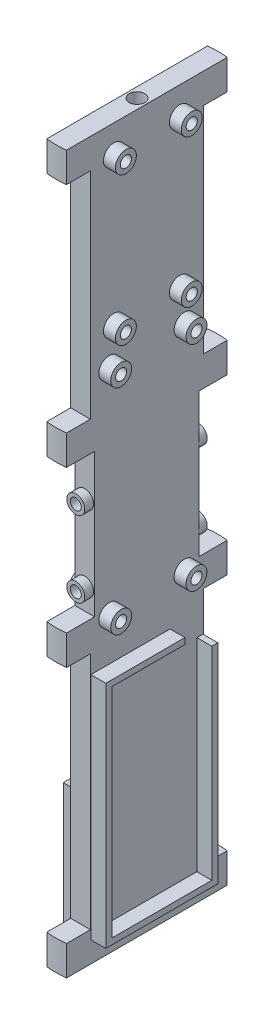
from build123d import *

# Parameters (mm, degrees)
SKETCH1_R                            = 1.651
BOSS_EXTRUDE1_DEPTH                  = 152.4
SKETCH2_W                            = 4.191
SKETCH2_H                            = 30.48
CUT_EXTRUDE1_DEPTH                   = 6.096
SKETCH3_R                            = 1.905
BOSS_EXTRUDE2_DEPTH                  = 1.905
SKETCH4_R                            = 1.17475
CUT_EXTRUDE2_DEPTH                   = 6.35
SKETCH7_R                            = 2.2225
SKETCH7_R_2                          = 1.1811
STRATOLOGGER_MOUNTS_DEPTH            = 2.54
SKETCH8_R                            = 2.2225
SKETCH8_R_2                          = 1.1811
EASYMINI_MOUNTS_DEPTH                = 2.54
SKETCH9_W                            = 7.62
SKETCH9_H                            = 50.8
SKETCH9_H_2                          = 45.72
WIRE_PASSTHROUGHS_DEPTH              = 154.425737584
SKETCH12_R                           = 2.2225
SKETCH12_R_2                         = 1.1811
EGGFINDER_MINI_MOUNTS_SMALL_2S_DEPTH = 3.81
F_1S_LIPO_MOUINTS_SMALL_2S_DEPTH     = 3.175
BOSS_EXTRUDE5_DEPTH                  = 3.175


with BuildPart() as part:
    # Sketch1 → Boss-Extrude1 (new body)
    with BuildSketch(Plane(origin=(0, 0, 0), x_dir=(1, 0, 0), z_dir=(0, 1, 0))):
        with BuildLine():
            Line((2.0955, -17.080437699), (2.0955, 17.080437699))
            ThreePointArc((2.0955, 17.080437699), (0, 17.2085), (-2.0955, 17.080437699))
            Line((-2.0955, 17.080437699), (-2.0955, -17.080437699))
            ThreePointArc((-2.0955, -17.080437699), (0, -17.2085), (2.0955, -17.080437699))
        make_face()
        with Locations(Location((0, 0, 0), (0, 0, 90))):
            Circle(SKETCH1_R, mode=Mode.SUBTRACT)
    extrude(amount=BOSS_EXTRUDE1_DEPTH)

    # Sketch2 → Cut-Extrude1 (cut)
    with BuildSketch(Plane(origin=(0, 0, -17.2085), x_dir=(-1, 0, 0), z_dir=(0, 0, -1))):
        with Locations((0, 78.74)):
            Rectangle(SKETCH2_W, SKETCH2_H)
    cut_extrude1 = extrude(amount=-CUT_EXTRUDE1_DEPTH, mode=Mode.SUBTRACT)

    # Sketch3 → Boss-Extrude2 (add)
    with BuildSketch(Plane(origin=(0, 0, -11.1125), x_dir=(-1, 0, 0), z_dir=(0, 0, -1))):
        with Locations(Location((0, 68.0339, 0), (0, 0, 180))):
            Circle(SKETCH3_R)
        with Locations(Location((0, 84.1629, 0), (0, 0, 180))):
            Circle(SKETCH3_R)
    boss_extrude2 = extrude(amount=BOSS_EXTRUDE2_DEPTH)

    # Sketch4 → Cut-Extrude2 (cut)
    with BuildSketch(Plane(origin=(0, 0, -13.0175), x_dir=(-1, 0, 0), z_dir=(0, 0, -1))):
        with Locations((0, 84.1629)):
            Circle(SKETCH4_R)
        with Locations((0, 68.0339)):
            Circle(SKETCH4_R)
    cut_extrude2 = extrude(amount=-CUT_EXTRUDE2_DEPTH, mode=Mode.SUBTRACT)

    # Mirror1: Cut-Extrude1, Boss-Extrude2, Cut-Extrude2 across plane
    add(cut_extrude1.mirror(Plane.XY), mode=Mode.SUBTRACT)
    add(boss_extrude2.mirror(Plane.XY))
    add(cut_extrude2.mirror(Plane.XY), mode=Mode.SUBTRACT)

    # Sketch7 → Stratologger Mounts (add)
    # profile 1 of 4: a face of its own
    with BuildSketch(Plane(origin=(2.0955, 0, 0), x_dir=(0, 0, -1), z_dir=(1, 0, 0))):
        with Locations(Location((8.001, 62.357, 0), (0, 0, 180))):
            Circle(SKETCH7_R)
        with Locations((8.001, 62.357)):
            Circle(SKETCH7_R_2, mode=Mode.SUBTRACT)
    # profile 2 of 4: a face of its own
    with BuildSketch(Plane(origin=(2.0955, 0, 0), x_dir=(0, 0, -1), z_dir=(1, 0, 0))):
        with Locations(Location((-8.001, 62.357, 0), (0, 0, 180))):
            Circle(SKETCH7_R)
        with Locations((-8.001, 62.357)):
            Circle(SKETCH7_R_2, mode=Mode.SUBTRACT)
    # profile 3 of 4: a face of its own
    with BuildSketch(Plane(origin=(2.0955, 0, 0), x_dir=(0, 0, -1), z_dir=(1, 0, 0))):
        with Locations(Location((-8.001, 107.823, 0), (0, 0, 180))):
            Circle(SKETCH7_R)
        with Locations((-8.001, 107.823)):
            Circle(SKETCH7_R_2, mode=Mode.SUBTRACT)
    # profile 4 of 4: a face of its own
    with BuildSketch(Plane(origin=(2.0955, 0, 0), x_dir=(0, 0, -1), z_dir=(1, 0, 0))):
        with Locations(Location((8.001, 107.823, 0), (0, 0, 180))):
            Circle(SKETCH7_R)
        with Locations((8.001, 107.823)):
            Circle(SKETCH7_R_2, mode=Mode.SUBTRACT)
    extrude(amount=STRATOLOGGER_MOUNTS_DEPTH)

    # Sketch8 → EasyMini Mounts (add)
    # profile 1 of 4: a face of its own
    with BuildSketch(Plane(origin=(2.0955, 0, 0), x_dir=(0, 0, -1), z_dir=(1, 0, 0))):
        with Locations(Location((7, 115.11, 0), (0, 0, 180))):
            Circle(SKETCH8_R)
        with Locations((7, 115.11)):
            Circle(SKETCH8_R_2, mode=Mode.SUBTRACT)
    # profile 2 of 4: a face of its own
    with BuildSketch(Plane(origin=(2.0955, 0, 0), x_dir=(0, 0, -1), z_dir=(1, 0, 0))):
        with Locations(Location((-7, 115.11, 0), (0, 0, 180))):
            Circle(SKETCH8_R)
        with Locations((-7, 115.11)):
            Circle(SKETCH8_R_2, mode=Mode.SUBTRACT)
    # profile 3 of 4: a face of its own
    with BuildSketch(Plane(origin=(2.0955, 0, 0), x_dir=(0, 0, -1), z_dir=(1, 0, 0))):
        with Locations(Location((-7, 146.51, 0), (0, 0, 180))):
            Circle(SKETCH8_R)
        with Locations((-7, 146.51)):
            Circle(SKETCH8_R_2, mode=Mode.SUBTRACT)
    # profile 4 of 4: a face of its own
    with BuildSketch(Plane(origin=(2.0955, 0, 0), x_dir=(0, 0, -1), z_dir=(1, 0, 0))):
        with Locations(Location((7, 146.51, 0), (0, 0, 180))):
            Circle(SKETCH8_R)
        with Locations((7, 146.51)):
            Circle(SKETCH8_R_2, mode=Mode.SUBTRACT)
    extrude(amount=EASYMINI_MOUNTS_DEPTH)

    # Sketch9 → Wire Passthroughs (cut, through all)
    with BuildSketch(Plane(origin=(2.0955, 0, 0), x_dir=(0, 0, -1), z_dir=(1, 0, 0))):
        with Locations((15.810437699, 31.75)):
            Rectangle(SKETCH9_W, SKETCH9_H)
        with Locations((-15.810437699, 31.75)):
            Rectangle(SKETCH9_W, SKETCH9_H)
        with Locations((-15.810437699, 123.19)):
            Rectangle(SKETCH9_W, SKETCH9_H_2)
        with Locations((15.810437699, 123.19)):
            Rectangle(SKETCH9_W, SKETCH9_H_2)
    extrude(amount=-WIRE_PASSTHROUGHS_DEPTH, mode=Mode.SUBTRACT)

    # Sketch12 → Eggfinder Mini Mounts Small 2s (add)
    # profile 1 of 2: a face of its own
    with BuildSketch(Plane.ZY.offset(2.0955)):
        with Locations(Location((-6.2865, 103.9495, 0), (0, 0, 180))):
            Circle(SKETCH12_R)
        with Locations((-6.2865, 103.9495)):
            Circle(SKETCH12_R_2, mode=Mode.SUBTRACT)
    # profile 2 of 2: a face of its own
    with BuildSketch(Plane.ZY.offset(2.0955)):
        with Locations(Location((6.2865, 63.6905, 0), (0, 0, 180))):
            Circle(SKETCH12_R)
        with Locations((6.2865, 63.6905)):
            Circle(SKETCH12_R_2, mode=Mode.SUBTRACT)
    extrude(amount=EGGFINDER_MINI_MOUNTS_SMALL_2S_DEPTH)

    # Sketch13 → 1s LiPo Mouints Small 2s (add)
    with BuildSketch(Plane.ZY.offset(2.0955)):
        Polygon((-9.134134948, 1.905), (9.134134948, 1.905), (9.134134948, 27.675), (-5.324134948, 27.675), (-5.324134948, 28.945), (10.404134948, 28.945), (10.404134948, 0.635), (-10.404134948, 0.635), (-10.404134948, 24.5), (-9.134134948, 24.5), align=None)
    extrude(amount=F_1S_LIPO_MOUINTS_SMALL_2S_DEPTH)

    # Sketch14 → Boss-Extrude5 (add)
    with BuildSketch(Plane(origin=(2.0955, 0, 0), x_dir=(0, 0, -1), z_dir=(1, 0, 0))):
        Polygon((-10.635, 5.715), (10.635, 5.715), (10.635, 48.81), (11.905, 48.81), (11.905, 4.445), (-11.905, 4.445), (-11.905, 53.255), (4.92, 53.255), (4.92, 51.985), (-10.635, 51.985), align=None)
    extrude(amount=BOSS_EXTRUDE5_DEPTH)


solid = part.part
